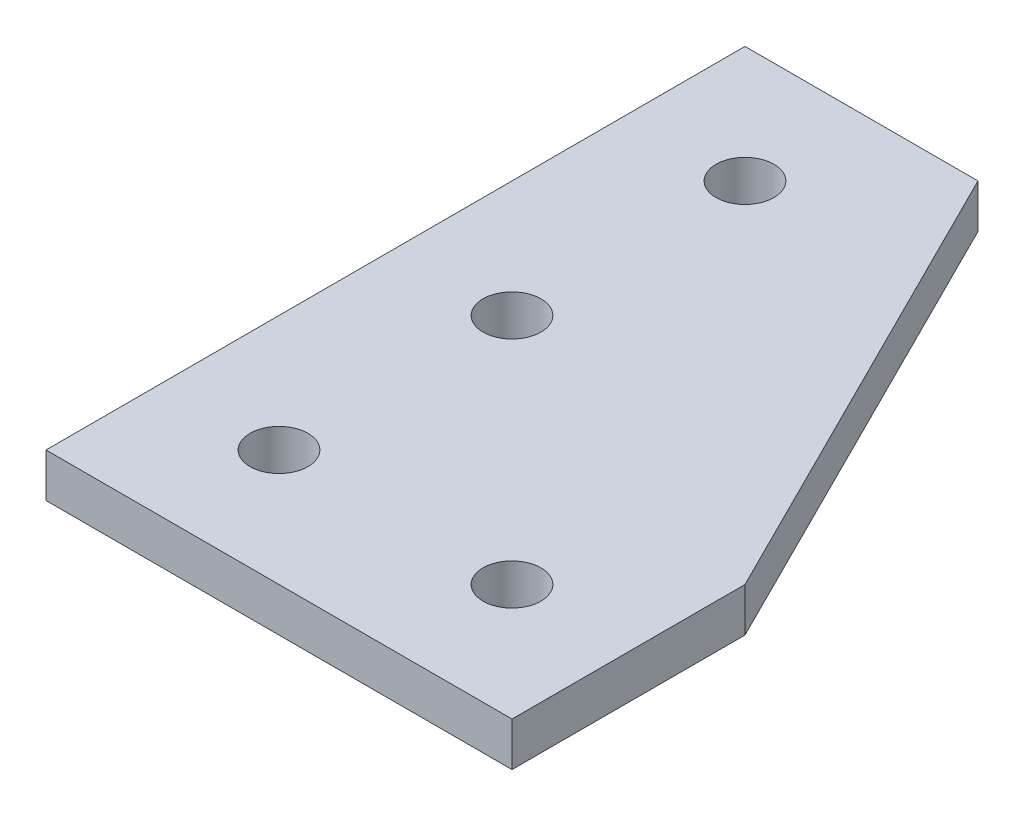
from build123d import *

# Parameters (mm, degrees)
SKETCH1_W            = 50.8
SKETCH1_H            = 4.7752
BOSS_EXTRUDE1_DEPTH  = 38.1
CUT_EXTRUDE2_DEPTH   = 7.62
SKETCH9_R            = 3.151882158
CUT_EXTRUDE3_DEPTH   = 47.038815526
LPATTERN1_COUNT      = 3
LPATTERN1_PITCH      = 25.4
LPATTERN1_COUNT_DIR2 = 2
LPATTERN1_PITCH_DIR2 = 25.4


with BuildPart() as part:
    # Sketch1 → Boss-Extrude1 (new, symmetric)
    with BuildSketch(Plane.XY):
        Rectangle(SKETCH1_W, SKETCH1_H)
    extrude(amount=BOSS_EXTRUDE1_DEPTH, both=True)

    # Sketch8 → Cut-Extrude2 (cut)
    with BuildSketch(Plane(origin=(0, 2.3876, 0), x_dir=(-1, 0, 0), z_dir=(0, 1, 0))):
        Polygon((0, -38.1), (-25.4, 12.7), (-25.4, -38.1), align=None)
    extrude(amount=-CUT_EXTRUDE2_DEPTH, mode=Mode.SUBTRACT)

    # Sketch9 → Cut-Extrude3 (cut, through all)
    with BuildSketch(Plane(origin=(0, 2.3876, 0), x_dir=(1, 0, 0), z_dir=(0, 1, 0))):
        with Locations(Location((-12.7, 25.4, 0), (0, 0, 270))):
            Circle(SKETCH9_R)
    cut_extrude3 = extrude(amount=-CUT_EXTRUDE3_DEPTH, mode=Mode.SUBTRACT)

    # LPattern1: Cut-Extrude3 3 × 2, 2 skipped
    with Locations(*[(j * LPATTERN1_PITCH_DIR2, 0, i * LPATTERN1_PITCH) for i in range(LPATTERN1_COUNT) for j in range(LPATTERN1_COUNT_DIR2) if (i, j) not in ((0, 0), (0, 1), (1, 1))]):
        add(cut_extrude3, mode=Mode.SUBTRACT)


solid = part.part
